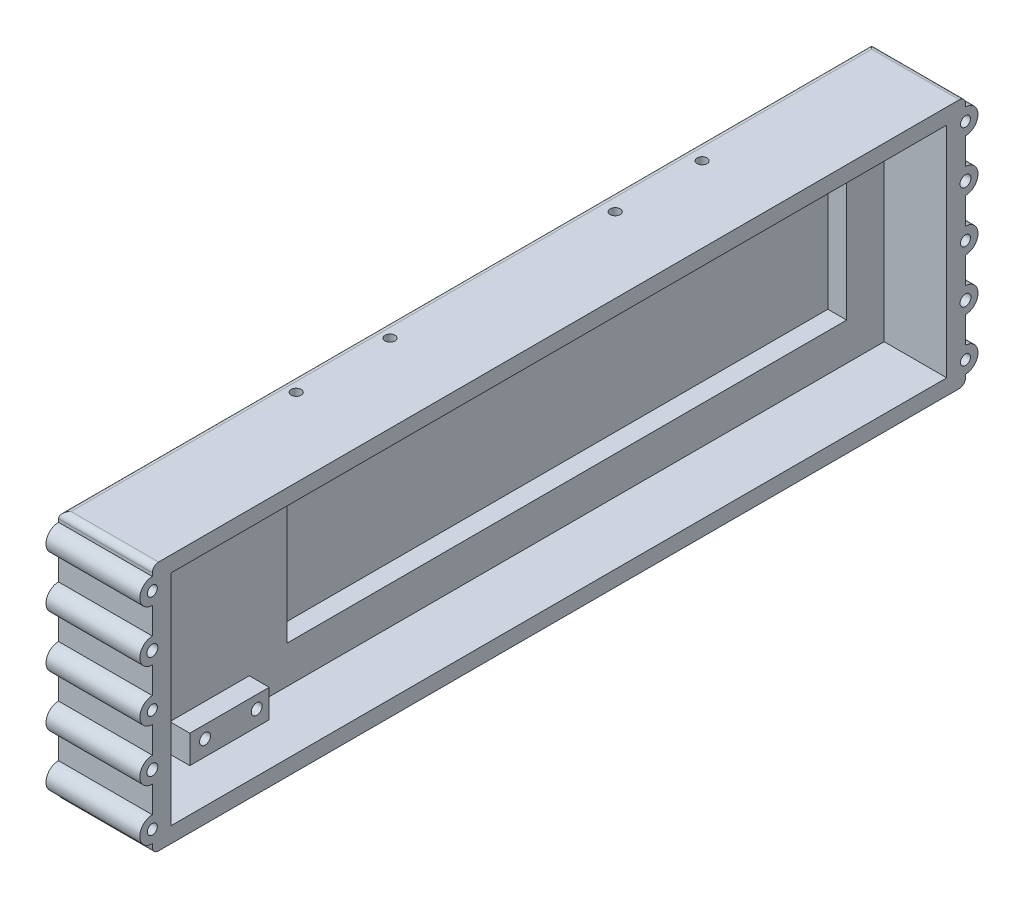
from build123d import *

# Parameters (mm, degrees)
SKETCH_1_W                  = 126
SKETCH_1_H                  = 37
SKETCH_1_W_2                = 124
SKETCH_1_H_2                = 35
EXTRUDE_1_DEPTH             = 10
SKETCH_2_W                  = 126
SKETCH_2_H                  = 37
EXTRUDE_2_DEPTH             = 1
SKETCH_3_W                  = 10
SKETCH_3_H                  = 37
EXTRUDE_3_DEPTH             = 2
SKETCH_4_W                  = 10
SKETCH_4_H                  = 37
EXTRUDE_4_DEPTH             = 2
SKETCH_5_W                  = 22.5
SKETCH_5_H                  = 35
EXTRUDE_5_DEPTH             = 2.19
SKETCH_6_W                  = 18.9
SKETCH_6_H                  = 26
CUT_EXTRUDE_2_DEPTH         = 7
SKETCH_7_W                  = 1.8
SKETCH_7_H                  = 26
CUT_EXTRUDE_3_DEPTH         = 4
M2_2X0_45_2_AT_2_COUNT      = 2
M2_2X0_45_2_AT_2_PITCH      = 8.26
SKETCH_10_R                 = 2
EXTRUDE_6_DEPTH             = 10
PATTERN_LINEAR_1_COUNT      = 5
PATTERN_LINEAR_1_PITCH      = 8.25
MIRROR_2_COPY_1_SKETCH_R    = 2
MIRROR_2_COPY_1_DEPTH       = 10
MIRROR_2_COPY_2_SKETCH_R    = 2
MIRROR_2_COPY_2_DEPTH       = 10
MIRROR_2_COPY_3_SKETCH_R    = 2
MIRROR_2_COPY_3_DEPTH       = 10
MIRROR_2_COPY_4_SKETCH_R    = 2
MIRROR_2_COPY_4_DEPTH       = 10
M2_2X0_45_3_AT_2_COUNT      = 2
M2_2X0_45_3_AT_2_PITCH      = 16.5
SKETCH_13_R                 = 0.8
CUT_EXTRUDE_4_DEPTH         = 71.222859526
EXTRUDE_START               = 5
SKETCH_14_R                 = 0.8
SKETCH_14_R_2               = 0.875
EXTRUDE_7_DEPTH             = 5
SKETCH_15_W                 = 101.5
SKETCH_15_H                 = 35
CUT_EXTRUDE_5_DEPTH         = 1
EXTRUDE_8_DEPTH             = 4.5
SKETCH_18_R                 = 2.95
EXTRUDE_9_DEPTH             = 3.5
SKETCH_19_R                 = 1.025
CUT_EXTRUDE_7_DEPTH         = 0.65
EXTRUDE_10_DEPTH            = 1.5
CHAMFER_1_SIZE              = 1.5
HOLE_WIZARD_M2_3_AT_2_COUNT = 2
HOLE_WIZARD_M2_3_AT_2_PITCH = 15
HOLE_WIZARD_M2_3_AT_3_COUNT = 2
HOLE_WIZARD_M2_3_AT_3_PITCH = 40
HOLE_WIZARD_M2_3_AT_4_COUNT = 2
HOLE_WIZARD_M2_3_AT_4_PITCH = 75
FILLET_2_R                  = 0.5
SKETCH_23_R                 = 1.404261487
EXTRUDE_11_DEPTH            = 8
M2_2X0_45_1_D               = 1.75
M2_2X0_45_1_DEPTH           = 5.75
M2_2X0_45_1_TIP             = 0.525753042
SKETCH_16_W                 = 9.8
SKETCH_16_H                 = 12
CUT_EXTRUDE_8_DEPTH         = 6
SKETCH_27_W                 = 8
SKETCH_27_H                 = 3
CUT_EXTRUDE_9_DEPTH         = 3.19
SKETCH_28_R                 = 1
SKETCH_28_R_2               = 2.011065783
EXTRUDE_12_DEPTH            = 40
HOLE_WIZARD_M2_5_AT_2_COUNT = 2
HOLE_WIZARD_M2_5_AT_2_PITCH = 14.000415164
SKETCH_31_W                 = 89.5
SKETCH_31_H                 = 23
CUT_EXTRUDE_10_DEPTH        = 3
FILLET_3_R                  = 1
FILLET_4_R                  = 0.5
CUT_EXTRUDE_START           = -10
SKETCH_32_R                 = 0.875
CUT_EXTRUDE_11_DEPTH        = 10
HOLE_WIZARD_M2_5_1_D        = 2.05
HOLE_WIZARD_M2_5_1_DEPTH    = 4.35
HOLE_WIZARD_M2_5_1_TIP      = 0.615882135
HOLE_WIZARD_M2_5_2_D        = 2.05
HOLE_WIZARD_M2_5_2_DEPTH    = 4.35
HOLE_WIZARD_M2_5_2_TIP      = 0.615882135
SKETCH_37_W                 = 15.88891709
SKETCH_37_H                 = 8.846088843
SKETCH_37_W_2               = 12.988941584
SKETCH_37_H_2               = 7.120984174
CUT_EXTRUDE_12_DEPTH        = 130


with BuildPart() as part:
    # 草图1 → 凸台-拉伸1 (new body)
    with BuildSketch(Plane(origin=(0, 0, 0), x_dir=(0, 0, -1), z_dir=(1, 0, 0))):
        Rectangle(SKETCH_1_W, SKETCH_1_H)
        Rectangle(SKETCH_1_W_2, SKETCH_1_H_2, mode=Mode.SUBTRACT)
    extrude(amount=EXTRUDE_1_DEPTH)

    # 草图2 → 凸台-拉伸2 (add)
    with BuildSketch(Plane.ZY):
        Rectangle(SKETCH_2_W, SKETCH_2_H)
    extrude(amount=-EXTRUDE_2_DEPTH)

    # 草图3 → 凸台-拉伸3 (add)
    with BuildSketch(Plane(origin=(0, 0, -63), x_dir=(-1, 0, 0), z_dir=(0, 0, -1))):
        with Locations((-5, 0)):
            Rectangle(SKETCH_3_W, SKETCH_3_H)
    extrude(amount=EXTRUDE_3_DEPTH)

    # 草图4 → 凸台-拉伸4 (add)
    with BuildSketch(Plane.XY.offset(63)):
        with Locations((5, 0)):
            Rectangle(SKETCH_4_W, SKETCH_4_H)
    extrude(amount=EXTRUDE_4_DEPTH)

    # 草图5 → 凸台-拉伸5 (add)
    with BuildSketch(Plane(origin=(1, 0, 0), x_dir=(0, 0, -1), z_dir=(1, 0, 0))):
        with Locations((-50.75, 0)):
            Rectangle(SKETCH_5_W, SKETCH_5_H)
    extrude(amount=EXTRUDE_5_DEPTH)

    # 草图6 → 切除-拉伸2 (cut)
    with BuildSketch(Plane(origin=(3.19, 0, 0), x_dir=(0, 0, -1), z_dir=(1, 0, 0))):
        with Locations((-50.75, 0)):
            Rectangle(SKETCH_6_W, SKETCH_6_H)
    extrude(amount=-CUT_EXTRUDE_2_DEPTH, mode=Mode.SUBTRACT)

    # 草图7 → 切除-拉伸3 (cut)
    with BuildSketch(Plane(origin=(3.19, 0, 0), x_dir=(0, 0, -1), z_dir=(1, 0, 0))):
        with Locations((-40.4, 0)):
            Rectangle(SKETCH_7_W, SKETCH_7_H)
    extrude(amount=-CUT_EXTRUDE_3_DEPTH, mode=Mode.SUBTRACT)

    # 草图9 → M2.2x0.45 螺纹孔2 (revolve, cut)
    with BuildSketch(Plane(origin=(3.19, -15, 41.5), x_dir=(0, 0, -1), z_dir=(0, 1, 0))):
        Polygon((0, 0), (0, 6.275753042), (0.875, 5.75), (0.875, 0), align=None)
    m2_2x0_45_2 = revolve(axis=Axis((9.54, -15, 41.5), (-1, 0, 0)), mode=Mode.SUBTRACT)

    # M2.2x0.45 螺纹孔2 at 2: M2.2x0.45 螺纹孔2 ×2
    with Locations(*[(0, 0, i * M2_2X0_45_2_AT_2_PITCH) for i in range(1, M2_2X0_45_2_AT_2_COUNT)]):
        add(m2_2x0_45_2, mode=Mode.SUBTRACT)

    # 镜向1: M2.2x0.45 螺纹孔2 across plane
    add(m2_2x0_45_2.mirror(Plane.ZX), mode=Mode.SUBTRACT)

    # 镜向1 copy 1 sketch → 镜向1 copy 1 (revolve, cut)
    with BuildSketch(Plane(origin=(3.19, 15, 49.76), x_dir=(0, 0, -1), z_dir=(0, -1, 0))):
        Polygon((0, 0), (0, -6.275753042), (0.875, -5.75), (0.875, 0), align=None)
    revolve(axis=Axis((9.54, 15, 49.76), (1, 0, 0)), mode=Mode.SUBTRACT)

    # 草图10 → 凸台-拉伸6 (add)
    with BuildSketch(Plane.ZY):
        with Locations((-65, -16.5)):
            Circle(SKETCH_10_R)
    extrude_6 = extrude(amount=-EXTRUDE_6_DEPTH)

    # 阵列(线性)1: 凸台-拉伸6 ×5
    with Locations(*[(0, i * PATTERN_LINEAR_1_PITCH, 0) for i in range(1, PATTERN_LINEAR_1_COUNT)]):
        add(extrude_6)

    # 镜向2: 凸台-拉伸6 across plane
    add(extrude_6.mirror(Plane.XY))

    # 镜向2 copy 1 sketch → 镜向2 copy 1 (add)
    with BuildSketch(Plane(origin=(0, 8.25, 0), x_dir=(0, 0, -1), z_dir=(-1, 0, 0))):
        with Locations((-65, 16.5)):
            Circle(MIRROR_2_COPY_1_SKETCH_R)
    extrude(amount=-MIRROR_2_COPY_1_DEPTH)

    # 镜向2 copy 2 sketch → 镜向2 copy 2 (add)
    with BuildSketch(Plane(origin=(0, 16.5, 0), x_dir=(0, 0, -1), z_dir=(-1, 0, 0))):
        with Locations((-65, 16.5)):
            Circle(MIRROR_2_COPY_2_SKETCH_R)
    extrude(amount=-MIRROR_2_COPY_2_DEPTH)

    # 镜向2 copy 3 sketch → 镜向2 copy 3 (add)
    with BuildSketch(Plane(origin=(0, 24.75, 0), x_dir=(0, 0, -1), z_dir=(-1, 0, 0))):
        with Locations((-65, 16.5)):
            Circle(MIRROR_2_COPY_3_SKETCH_R)
    extrude(amount=-MIRROR_2_COPY_3_DEPTH)

    # 镜向2 copy 4 sketch → 镜向2 copy 4 (add)
    with BuildSketch(Plane(origin=(0, 33, 0), x_dir=(0, 0, -1), z_dir=(-1, 0, 0))):
        with Locations((-65, 16.5)):
            Circle(MIRROR_2_COPY_4_SKETCH_R)
    extrude(amount=-MIRROR_2_COPY_4_DEPTH)

    # 草图12 → M2.2x0.45 螺纹孔3 (revolve, cut)
    with BuildSketch(Plane(origin=(10, 8.25, 65), x_dir=(0, 0, -1), z_dir=(0, 1, 0))):
        Polygon((0, 0), (0, 6.275753042), (0.875, 5.75), (0.875, 0), align=None)
    m2_2x0_45_3 = revolve(axis=Axis((16.35, 8.25, 65), (-1, 0, 0)), mode=Mode.SUBTRACT)

    # M2.2x0.45 螺纹孔3 at 2: M2.2x0.45 螺纹孔3 ×2
    with Locations(*[(0, -i * M2_2X0_45_3_AT_2_PITCH, 0) for i in range(1, M2_2X0_45_3_AT_2_COUNT)]):
        add(m2_2x0_45_3, mode=Mode.SUBTRACT)

    # 草图13 → 切除-拉伸4 (cut, through all)
    with BuildSketch(Plane.ZY):
        with Locations((65, -16.5)):
            Circle(SKETCH_13_R)
        with Locations((65, 0)):
            Circle(SKETCH_13_R)
        with Locations((65, 16.5)):
            Circle(SKETCH_13_R)
    cut_extrude_4 = extrude(amount=-CUT_EXTRUDE_4_DEPTH, mode=Mode.SUBTRACT)

    # 镜向3: M2.2x0.45 螺纹孔3, 切除-拉伸4 across plane
    add(m2_2x0_45_3.mirror(Plane.XY), mode=Mode.SUBTRACT)
    add(cut_extrude_4.mirror(Plane.XY), mode=Mode.SUBTRACT)

    # 镜向3 copy 1 sketch → 镜向3 copy 1 (revolve, cut)
    with BuildSketch(Plane(origin=(10, -8.25, -65), x_dir=(0, 0, 1), z_dir=(0, 1, 0))):
        Polygon((0, 0), (0, -6.275753042), (0.875, -5.75), (0.875, 0), align=None)
    revolve(axis=Axis((16.35, -8.25, -65), (1, 0, 0)), mode=Mode.SUBTRACT)

    # 草图14 → 凸台-拉伸7 (add)
    with BuildSketch(Plane.ZY.offset(EXTRUDE_START)):
        with BuildLine():
            Line((65, 10.25), (65, 14.5))
            ThreePointArc((65, 14.5), (67, 16.5), (65, 18.5))
            Line((65, 18.5), (-65, 18.5))
            ThreePointArc((-65, 18.5), (-67, 16.5), (-65, 14.5))
            Line((-65, 14.5), (-65, 10.25))
            ThreePointArc((-65, 10.25), (-67, 8.25), (-65, 6.25))
            Line((-65, 6.25), (-65, 2))
            ThreePointArc((-65, 2), (-67, 0), (-65, -2))
            Line((-65, -2), (-65, -6.25))
            ThreePointArc((-65, -6.25), (-67, -8.25), (-65, -10.25))
            Line((-65, -10.25), (-65, -14.5))
            ThreePointArc((-65, -14.5), (-67, -16.5), (-65, -18.5))
            Line((-65, -18.5), (65, -18.5))
            ThreePointArc((65, -18.5), (67, -16.5), (65, -14.5))
            Line((65, -14.5), (65, -10.25))
            ThreePointArc((65, -10.25), (67, -8.25), (65, -6.25))
            Line((65, -6.25), (65, -2))
            ThreePointArc((65, -2), (67, 0), (65, 2))
            Line((65, 2), (65, 6.25))
            ThreePointArc((65, 6.25), (67, 8.25), (65, 10.25))
        make_face()
        with Locations((65, -16.5)):
            Circle(SKETCH_14_R, mode=Mode.SUBTRACT)
        with Locations((65, 0)):
            Circle(SKETCH_14_R, mode=Mode.SUBTRACT)
        with Locations((65, 16.5)):
            Circle(SKETCH_14_R, mode=Mode.SUBTRACT)
        with Locations((-65, 16.5)):
            Circle(SKETCH_14_R, mode=Mode.SUBTRACT)
        with Locations((-65, 0)):
            Circle(SKETCH_14_R, mode=Mode.SUBTRACT)
        with Locations((-65, -16.5)):
            Circle(SKETCH_14_R, mode=Mode.SUBTRACT)
        with Locations(Location((49.76, -15, 0), (0, 0, 180))):
            Circle(SKETCH_14_R_2, mode=Mode.SUBTRACT)
        with Locations(Location((41.5, -15, 0), (0, 0, 180))):
            Circle(SKETCH_14_R_2, mode=Mode.SUBTRACT)
        with Locations(Location((41.5, 15, 0), (0, 0, 180))):
            Circle(SKETCH_14_R_2, mode=Mode.SUBTRACT)
    extrude(amount=-EXTRUDE_7_DEPTH)

    # 草图15 → 切除-拉伸5 (cut)
    with BuildSketch(Plane(origin=(1, 0, 0), x_dir=(0, 0, -1), z_dir=(1, 0, 0))):
        with Locations((11.25, 0)):
            Rectangle(SKETCH_15_W, SKETCH_15_H)
    extrude(amount=-CUT_EXTRUDE_5_DEPTH, mode=Mode.SUBTRACT)

    # 草图17 → 凸台-拉伸8 (add)
    with BuildSketch(Plane(origin=(0, 18.5, 0), x_dir=(1, 0, 0), z_dir=(0, 1, 0))):
        with BuildLine():
            Line((10, -45.31662479), (10, -38.68337521))
            ThreePointArc((10, -38.68337521), (-1, -42), (10, -45.31662479))
        make_face()
    extrude_8 = extrude(amount=EXTRUDE_8_DEPTH)

    # 草图18 → 凸台-拉伸9 (add)
    with BuildSketch(Plane(origin=(0, 23, 0), x_dir=(1, 0, 0), z_dir=(0, 1, 0))):
        with Locations(Location((5, -42, 0), (0, 0, 270))):
            Circle(SKETCH_18_R)
    extrude_9 = extrude(amount=EXTRUDE_9_DEPTH)

    # 草图19 → 切除-拉伸7 (cut)
    with BuildSketch(Plane(origin=(0, 26.5, 0), x_dir=(1, 0, 0), z_dir=(0, 1, 0))):
        with Locations(Location((5, -42, 0), (0, 0, 270))):
            Circle(SKETCH_19_R)
    cut_extrude_7 = extrude(amount=-CUT_EXTRUDE_7_DEPTH, mode=Mode.SUBTRACT)

    # 草图20 → 凸台-拉伸10 (add)
    with BuildSketch(Plane(origin=(0, 18.5, 0), x_dir=(1, 0, 0), z_dir=(0, 1, 0))):
        with BuildLine():
            Line((10, 65), (-5, 65))
            Line((-5, 65), (-5, -65))
            Line((-5, -65), (10, -65))
            Line((10, -65), (10, -45.31662479))
            ThreePointArc((10, -45.31662479), (-1, -42), (10, -38.68337521))
            Line((10, -38.68337521), (10, 65))
        make_face()
    extrude_10 = extrude(amount=EXTRUDE_10_DEPTH)

    # 镜向6: 凸台-拉伸8, 凸台-拉伸9, 切除-拉伸7, 凸台-拉伸10 across plane
    add(extrude_8.mirror(Plane.ZX))
    add(extrude_9.mirror(Plane.ZX))
    add(cut_extrude_7.mirror(Plane.ZX), mode=Mode.SUBTRACT)
    add(extrude_10.mirror(Plane.ZX))

    # 倒角1
    chamfer_1_edges = [part.edges().sort_by_distance(p)[0] for p in [
        (-1, 20, 42),
        (-1, -20, 42),
    ]]
    chamfer(chamfer_1_edges, length=CHAMFER_1_SIZE)

    # 草图22 → M2 螺纹孔3 (revolve, cut)
    with BuildSketch(Plane(origin=(-2.5, -20, 29.5), x_dir=(0, 0, -1), z_dir=(1, 0, 0))):
        Polygon((0, 0), (0, 5.680688495), (0.8, 5.2), (0.8, 0), align=None)
    hole_wizard_m2_3 = revolve(axis=Axis((-2.5, -26.35, 29.5), (0, 1, 0)), mode=Mode.SUBTRACT)

    # M2 螺纹孔3 at 2: M2 螺纹孔3 ×2
    with Locations(*[(0, 0, -i * HOLE_WIZARD_M2_3_AT_2_PITCH) for i in range(1, HOLE_WIZARD_M2_3_AT_2_COUNT)]):
        add(hole_wizard_m2_3, mode=Mode.SUBTRACT)

    # M2 螺纹孔3 at 3: M2 螺纹孔3 ×2
    with Locations(*[(0, 0, -i * HOLE_WIZARD_M2_3_AT_3_PITCH) for i in range(1, HOLE_WIZARD_M2_3_AT_3_COUNT)]):
        add(hole_wizard_m2_3, mode=Mode.SUBTRACT)

    # M2 螺纹孔3 at 4: M2 螺纹孔3 ×2
    with Locations(*[(0, 0, -i * HOLE_WIZARD_M2_3_AT_4_PITCH) for i in range(1, HOLE_WIZARD_M2_3_AT_4_COUNT)]):
        add(hole_wizard_m2_3, mode=Mode.SUBTRACT)

    # 镜向7: M2 螺纹孔3 across plane
    add(hole_wizard_m2_3.mirror(Plane.ZX), mode=Mode.SUBTRACT)

    # 镜向7 copy 1 sketch → 镜向7 copy 1 (revolve, cut)
    with BuildSketch(Plane(origin=(-2.5, 20, 14.5), x_dir=(0, 0, -1), z_dir=(1, 0, 0))):
        Polygon((0, 0), (0, -5.680688495), (0.8, -5.2), (0.8, 0), align=None)
    revolve(axis=Axis((-2.5, 26.35, 14.5), (0, 1, 0)), mode=Mode.SUBTRACT)

    # 镜向7 copy 2 sketch → 镜向7 copy 2 (revolve, cut)
    with BuildSketch(Plane(origin=(-2.5, 20, -10.5), x_dir=(0, 0, -1), z_dir=(1, 0, 0))):
        Polygon((0, 0), (0, -5.680688495), (0.8, -5.2), (0.8, 0), align=None)
    revolve(axis=Axis((-2.5, 26.35, -10.5), (0, 1, 0)), mode=Mode.SUBTRACT)

    # 镜向7 copy 3 sketch → 镜向7 copy 3 (revolve, cut)
    with BuildSketch(Plane(origin=(-2.5, 20, -45.5), x_dir=(0, 0, -1), z_dir=(1, 0, 0))):
        Polygon((0, 0), (0, -5.680688495), (0.8, -5.2), (0.8, 0), align=None)
    revolve(axis=Axis((-2.5, 26.35, -45.5), (0, 1, 0)), mode=Mode.SUBTRACT)

    # 圆角2
    fillet_2_edges = [part.edges().sort_by_distance(p)[0] for p in [
        (5, 26.5, 39.05),
        (5, -26.5, 39.05),
    ]]
    fillet(fillet_2_edges, radius=FILLET_2_R)

    # 草图23 → 凸台-拉伸11 (add)
    with BuildSketch(Plane(origin=(3.19, 0, 0), x_dir=(0, 0, -1), z_dir=(1, 0, 0))):
        with Locations((-49.76, 15)):
            Circle(SKETCH_23_R)
    extrude(amount=-EXTRUDE_11_DEPTH)

    # M2.2x0.45 螺纹孔1
    with Locations(Plane(origin=(3.19, 15, 48.5), x_dir=(0, 0, 1), z_dir=(1, 0, 0))):
        with Locations((0, 0)):
            Hole(M2_2X0_45_1_D / 2, depth=M2_2X0_45_1_DEPTH)
            with Locations((0, 0, -(M2_2X0_45_1_DEPTH + M2_2X0_45_1_TIP / 2))):  # 118° drill point
                Cone(0, M2_2X0_45_1_D / 2, M2_2X0_45_1_TIP, mode=Mode.SUBTRACT)

    # 草图16 → 切除-拉伸8 (cut)
    with BuildSketch(Plane(origin=(3.19, 0, 0), x_dir=(0, 0, -1), z_dir=(1, 0, 0))):
        with Locations((-57.1, -11.5)):
            Rectangle(SKETCH_16_W, SKETCH_16_H)
    extrude(amount=-CUT_EXTRUDE_8_DEPTH, mode=Mode.SUBTRACT)

    # 草图27 → 切除-拉伸9 (cut)
    with BuildSketch(Plane(origin=(3.19, 0, 0), x_dir=(0, 0, -1), z_dir=(1, 0, 0))):
        with Locations((-56.2, 14.5)):
            Rectangle(SKETCH_27_W, SKETCH_27_H)
    extrude(amount=-CUT_EXTRUDE_9_DEPTH, mode=Mode.SUBTRACT)

    # 草图28 → 凸台-拉伸12 (add)
    with BuildSketch(Plane.XZ.offset(20)):
        with Locations((-2.5, -10.5)):
            Circle(SKETCH_28_R)
        with Locations((-2.5, -45.5)):
            Circle(SKETCH_28_R_2)
    extrude(amount=-EXTRUDE_12_DEPTH)

    # 草图30 → M2 螺纹孔5 (revolve, cut)
    with BuildSketch(Plane(origin=(-2.107818173, -20, -35), x_dir=(0, 0, -1), z_dir=(1, 0, 0))):
        Polygon((0, 0), (0, 5.680688495), (0.8, 5.2), (0.8, 0), align=None)
    hole_wizard_m2_5 = revolve(axis=Axis((-2.107818173, -26.35, -35), (0, 1, 0)), mode=Mode.SUBTRACT)

    # M2 螺纹孔5 at 2: M2 螺纹孔5 ×2
    with Locations(*[Vector(0.007701069674383212, 0, 0.999970346323265) * (i * HOLE_WIZARD_M2_5_AT_2_PITCH) for i in range(1, HOLE_WIZARD_M2_5_AT_2_COUNT)]):
        add(hole_wizard_m2_5, mode=Mode.SUBTRACT)

    # 镜向8: M2 螺纹孔5 across plane
    add(hole_wizard_m2_5.mirror(Plane.ZX), mode=Mode.SUBTRACT)

    # 镜向8 copy 1 sketch → 镜向8 copy 1 (revolve, cut)
    with BuildSketch(Plane(origin=(-2, 20, -21), x_dir=(0, 0, -1), z_dir=(1, 0, 0))):
        Polygon((0, 0), (0, -5.680688495), (0.8, -5.2), (0.8, 0), align=None)
    revolve(axis=Axis((-2, 26.35, -21), (0, 1, 0)), mode=Mode.SUBTRACT)

    # 草图31 → 切除-拉伸10 (cut)
    with BuildSketch(Plane(origin=(0, 0, 0), x_dir=(0, 0, -1), z_dir=(1, 0, 0))):
        with Locations((11.25, 0)):
            Rectangle(SKETCH_31_W, SKETCH_31_H)
    extrude(amount=-CUT_EXTRUDE_10_DEPTH, mode=Mode.SUBTRACT)

    # 圆角3
    fillet_3_edges = [part.edges().sort_by_distance(p)[0] for p in [
        (2.5, 20, -65),
        (-5, 20, 0),
        (2.5, 20, 65),
        (2.5, -20, 65),
        (-5, -20, 0),
        (2.5, -20, -65),
    ]]
    fillet(fillet_3_edges, radius=FILLET_3_R)

    # 圆角4
    fillet_4_edges = [part.edges().sort_by_distance(p)[0] for p in [
        (5, 23, 39.05),
        (5, -23, 39.05),
    ]]
    fillet(fillet_4_edges, radius=FILLET_4_R)

    # 草图32 → 切除-拉伸11 (cut)
    with BuildSketch(Plane(origin=(3.19, 0, 0), x_dir=(0, 0, -1), z_dir=(1, 0, 0)).offset(CUT_EXTRUDE_START)):
        with Locations((-48.5, 15)):
            Circle(SKETCH_32_R)
    extrude(amount=CUT_EXTRUDE_11_DEPTH, mode=Mode.SUBTRACT)

    # M2.5 螺纹孔1
    with Locations(Plane(origin=(5, 25.85, 42), x_dir=(0, 0, 1), z_dir=(0, 1, 0))):
        with Locations((0, 0)):
            Hole(HOLE_WIZARD_M2_5_1_D / 2, depth=HOLE_WIZARD_M2_5_1_DEPTH)
            with Locations((0, 0, -(HOLE_WIZARD_M2_5_1_DEPTH + HOLE_WIZARD_M2_5_1_TIP / 2))):  # 118° drill point
                Cone(0, HOLE_WIZARD_M2_5_1_D / 2, HOLE_WIZARD_M2_5_1_TIP, mode=Mode.SUBTRACT)

    # M2.5 螺纹孔2
    with Locations(Plane(origin=(5, -25.85, 42), x_dir=(0, 0, -1), z_dir=(0, -1, 0))):
        with Locations((0, 0)):
            Hole(HOLE_WIZARD_M2_5_2_D / 2, depth=HOLE_WIZARD_M2_5_2_DEPTH)
            with Locations((0, 0, -(HOLE_WIZARD_M2_5_2_DEPTH + HOLE_WIZARD_M2_5_2_TIP / 2))):  # 118° drill point
                Cone(0, HOLE_WIZARD_M2_5_2_D / 2, HOLE_WIZARD_M2_5_2_TIP, mode=Mode.SUBTRACT)

    # 草图37 → 切除-拉伸12 (cut)
    with BuildSketch(Plane.XY.offset(65)):
        with Locations((5.444458545, 24.423044422)):
            Rectangle(SKETCH_37_W, SKETCH_37_H)
        with Locations((3.994470792, -23.560492087)):
            Rectangle(SKETCH_37_W_2, SKETCH_37_H_2)
    extrude(amount=-CUT_EXTRUDE_12_DEPTH, mode=Mode.SUBTRACT)


solid = part.part
